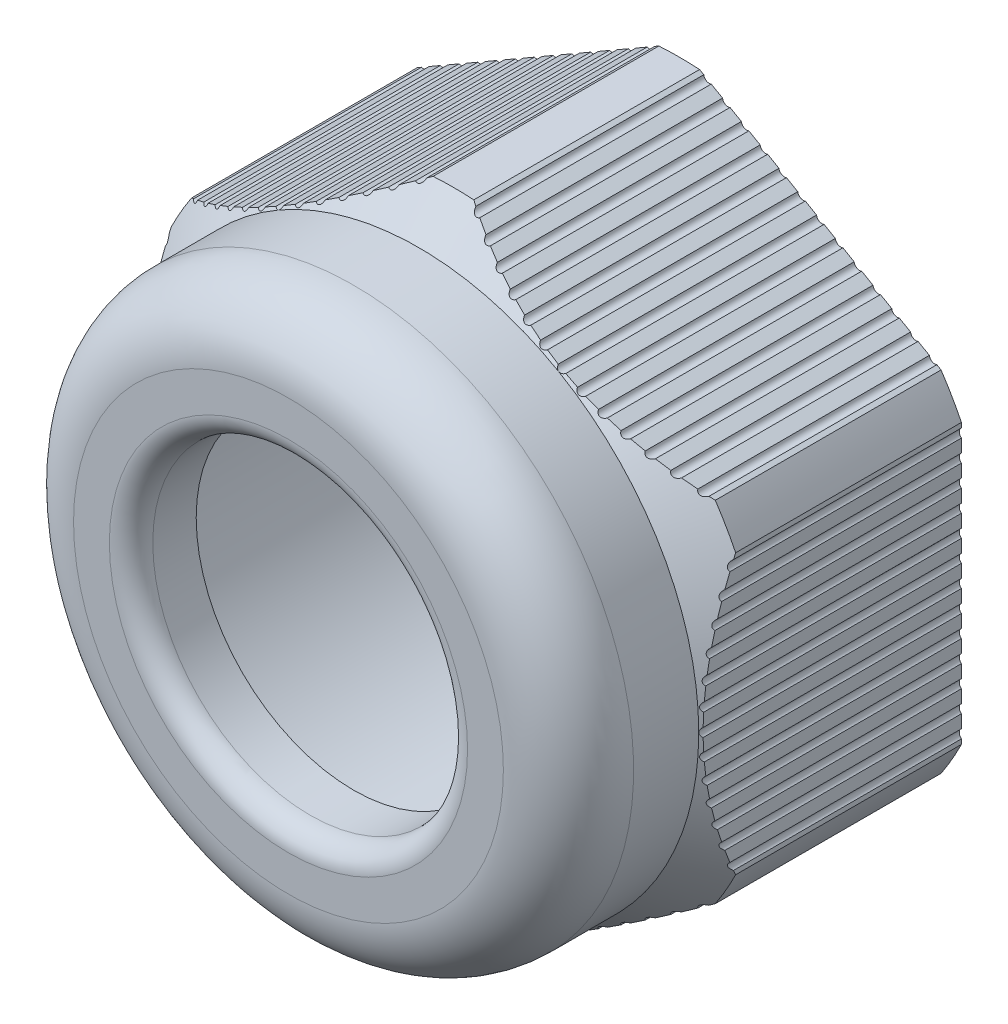
from build123d import *

# Parameters (mm, degrees)
EXTRUDE_1_DEPTH                     = 12
SKETCH_3_R                          = 15.011106999
SKETCH_3_R_2                        = 14.5
CUT_EXTRUDE_1_DEPTH                 = 12
SKETCH_4_R                          = 12.9
EXTRUDE_3_DEPTH                     = 6
FILLET_1_R                          = 3
SKETCH_5_R                          = 7.25
CUT_EXTRUDE_2_DEPTH                 = 27.518861212
SKETCH_6_R                          = 10.75
CUT_EXTRUDE_3_DEPTH                 = 15
FILLET_2_R                          = 1
CHAMFER_1_SIZE                      = 2
CHAMFER_1_SIZE2                     = 3.464101615
SKETCH_8_R                          = 0.25
CUT_EXTRUDE_4_DEPTH                 = 27.518861212
PATTERN_LINEAR_1_COUNT              = 7
PATTERN_LINEAR_1_PITCH              = 1
PATTERN_LINEAR_1_COL_COUNT          = 7
PATTERN_LINEAR_1_COL_PITCH          = 1
PATTERN_CIRCULAR_1_COUNT            = 6
PATTERN_CIRCULAR_1_COPY_1_SKETCH_R  = 0.25
PATTERN_CIRCULAR_1_COPY_1_DEPTH     = 27.518861212
PATTERN_CIRCULAR_1_COPY_2_SKETCH_R  = 0.25
PATTERN_CIRCULAR_1_COPY_2_DEPTH     = 27.518861212
PATTERN_CIRCULAR_1_COPY_3_SKETCH_R  = 0.25
PATTERN_CIRCULAR_1_COPY_3_DEPTH     = 27.518861212
PATTERN_CIRCULAR_1_COPY_4_SKETCH_R  = 0.25
PATTERN_CIRCULAR_1_COPY_4_DEPTH     = 27.518861212
PATTERN_CIRCULAR_1_COPY_5_SKETCH_R  = 0.25
PATTERN_CIRCULAR_1_COPY_5_DEPTH     = 27.518861212
PATTERN_CIRCULAR_1_COPY_6_SKETCH_R  = 0.25
PATTERN_CIRCULAR_1_COPY_6_DEPTH     = 27.518861212
PATTERN_CIRCULAR_1_COPY_7_SKETCH_R  = 0.25
PATTERN_CIRCULAR_1_COPY_7_DEPTH     = 27.518861212
PATTERN_CIRCULAR_1_COPY_8_SKETCH_R  = 0.25
PATTERN_CIRCULAR_1_COPY_8_DEPTH     = 27.518861212
PATTERN_CIRCULAR_1_COPY_9_SKETCH_R  = 0.25
PATTERN_CIRCULAR_1_COPY_9_DEPTH     = 27.518861212
PATTERN_CIRCULAR_1_COPY_10_SKETCH_R = 0.25
PATTERN_CIRCULAR_1_COPY_10_DEPTH    = 27.518861212
PATTERN_CIRCULAR_1_COPY_11_SKETCH_R = 0.25
PATTERN_CIRCULAR_1_COPY_11_DEPTH    = 27.518861212
PATTERN_CIRCULAR_1_COPY_12_SKETCH_R = 0.25
PATTERN_CIRCULAR_1_COPY_12_DEPTH    = 27.518861212
PATTERN_CIRCULAR_1_COPY_13_SKETCH_R = 0.25
PATTERN_CIRCULAR_1_COPY_13_DEPTH    = 27.518861212
PATTERN_CIRCULAR_1_COPY_14_SKETCH_R = 0.25
PATTERN_CIRCULAR_1_COPY_14_DEPTH    = 27.518861212
PATTERN_CIRCULAR_1_COPY_15_SKETCH_R = 0.25
PATTERN_CIRCULAR_1_COPY_15_DEPTH    = 27.518861212
PATTERN_CIRCULAR_1_COPY_16_SKETCH_R = 0.25
PATTERN_CIRCULAR_1_COPY_16_DEPTH    = 27.518861212
PATTERN_CIRCULAR_1_COPY_17_SKETCH_R = 0.25
PATTERN_CIRCULAR_1_COPY_17_DEPTH    = 27.518861212
PATTERN_CIRCULAR_1_COPY_18_SKETCH_R = 0.25
PATTERN_CIRCULAR_1_COPY_18_DEPTH    = 27.518861212
PATTERN_CIRCULAR_1_COPY_19_SKETCH_R = 0.25
PATTERN_CIRCULAR_1_COPY_19_DEPTH    = 27.518861212
PATTERN_CIRCULAR_1_COPY_20_SKETCH_R = 0.25
PATTERN_CIRCULAR_1_COPY_20_DEPTH    = 27.518861212
PATTERN_CIRCULAR_1_COPY_21_SKETCH_R = 0.25
PATTERN_CIRCULAR_1_COPY_21_DEPTH    = 27.518861212
PATTERN_CIRCULAR_1_COPY_22_SKETCH_R = 0.25
PATTERN_CIRCULAR_1_COPY_22_DEPTH    = 27.518861212
PATTERN_CIRCULAR_1_COPY_23_SKETCH_R = 0.25
PATTERN_CIRCULAR_1_COPY_23_DEPTH    = 27.518861212
PATTERN_CIRCULAR_1_COPY_24_SKETCH_R = 0.25
PATTERN_CIRCULAR_1_COPY_24_DEPTH    = 27.518861212
PATTERN_CIRCULAR_1_COPY_25_SKETCH_R = 0.25
PATTERN_CIRCULAR_1_COPY_25_DEPTH    = 27.518861212
PATTERN_CIRCULAR_1_COPY_26_SKETCH_R = 0.25
PATTERN_CIRCULAR_1_COPY_26_DEPTH    = 27.518861212
PATTERN_CIRCULAR_1_COPY_27_SKETCH_R = 0.25
PATTERN_CIRCULAR_1_COPY_27_DEPTH    = 27.518861212
PATTERN_CIRCULAR_1_COPY_28_SKETCH_R = 0.25
PATTERN_CIRCULAR_1_COPY_28_DEPTH    = 27.518861212
PATTERN_CIRCULAR_1_COPY_29_SKETCH_R = 0.25
PATTERN_CIRCULAR_1_COPY_29_DEPTH    = 27.518861212
PATTERN_CIRCULAR_1_COPY_30_SKETCH_R = 0.25
PATTERN_CIRCULAR_1_COPY_30_DEPTH    = 27.518861212
PATTERN_CIRCULAR_1_COPY_31_SKETCH_R = 0.25
PATTERN_CIRCULAR_1_COPY_31_DEPTH    = 27.518861212
PATTERN_CIRCULAR_1_COPY_32_SKETCH_R = 0.25
PATTERN_CIRCULAR_1_COPY_32_DEPTH    = 27.518861212
PATTERN_CIRCULAR_1_COPY_33_SKETCH_R = 0.25
PATTERN_CIRCULAR_1_COPY_33_DEPTH    = 27.518861212
PATTERN_CIRCULAR_1_COPY_34_SKETCH_R = 0.25
PATTERN_CIRCULAR_1_COPY_34_DEPTH    = 27.518861212
PATTERN_CIRCULAR_1_COPY_35_SKETCH_R = 0.25
PATTERN_CIRCULAR_1_COPY_35_DEPTH    = 27.518861212
PATTERN_CIRCULAR_1_COPY_36_SKETCH_R = 0.25
PATTERN_CIRCULAR_1_COPY_36_DEPTH    = 27.518861212
PATTERN_CIRCULAR_1_COPY_37_SKETCH_R = 0.25
PATTERN_CIRCULAR_1_COPY_37_DEPTH    = 27.518861212
PATTERN_CIRCULAR_1_COPY_38_SKETCH_R = 0.25
PATTERN_CIRCULAR_1_COPY_38_DEPTH    = 27.518861212
PATTERN_CIRCULAR_1_COPY_39_SKETCH_R = 0.25
PATTERN_CIRCULAR_1_COPY_39_DEPTH    = 27.518861212
PATTERN_CIRCULAR_1_COPY_40_SKETCH_R = 0.25
PATTERN_CIRCULAR_1_COPY_40_DEPTH    = 27.518861212
PATTERN_CIRCULAR_1_COPY_41_SKETCH_R = 0.25
PATTERN_CIRCULAR_1_COPY_41_DEPTH    = 27.518861212
PATTERN_CIRCULAR_1_COPY_42_SKETCH_R = 0.25
PATTERN_CIRCULAR_1_COPY_42_DEPTH    = 27.518861212
PATTERN_CIRCULAR_1_COPY_43_SKETCH_R = 0.25
PATTERN_CIRCULAR_1_COPY_43_DEPTH    = 27.518861212
PATTERN_CIRCULAR_1_COPY_44_SKETCH_R = 0.25
PATTERN_CIRCULAR_1_COPY_44_DEPTH    = 27.518861212
PATTERN_CIRCULAR_1_COPY_45_SKETCH_R = 0.25
PATTERN_CIRCULAR_1_COPY_45_DEPTH    = 27.518861212
PATTERN_CIRCULAR_1_COPY_46_SKETCH_R = 0.25
PATTERN_CIRCULAR_1_COPY_46_DEPTH    = 27.518861212
PATTERN_CIRCULAR_1_COPY_47_SKETCH_R = 0.25
PATTERN_CIRCULAR_1_COPY_47_DEPTH    = 27.518861212
PATTERN_CIRCULAR_1_COPY_48_SKETCH_R = 0.25
PATTERN_CIRCULAR_1_COPY_48_DEPTH    = 27.518861212
PATTERN_CIRCULAR_1_COPY_49_SKETCH_R = 0.25
PATTERN_CIRCULAR_1_COPY_49_DEPTH    = 27.518861212
PATTERN_CIRCULAR_1_COPY_50_SKETCH_R = 0.25
PATTERN_CIRCULAR_1_COPY_50_DEPTH    = 27.518861212
PATTERN_CIRCULAR_1_COPY_51_SKETCH_R = 0.25
PATTERN_CIRCULAR_1_COPY_51_DEPTH    = 27.518861212
PATTERN_CIRCULAR_1_COPY_52_SKETCH_R = 0.25
PATTERN_CIRCULAR_1_COPY_52_DEPTH    = 27.518861212
PATTERN_CIRCULAR_1_COPY_53_SKETCH_R = 0.25
PATTERN_CIRCULAR_1_COPY_53_DEPTH    = 27.518861212
PATTERN_CIRCULAR_1_COPY_54_SKETCH_R = 0.25
PATTERN_CIRCULAR_1_COPY_54_DEPTH    = 27.518861212
PATTERN_CIRCULAR_1_COPY_55_SKETCH_R = 0.25
PATTERN_CIRCULAR_1_COPY_55_DEPTH    = 27.518861212
PATTERN_CIRCULAR_1_COPY_56_SKETCH_R = 0.25
PATTERN_CIRCULAR_1_COPY_56_DEPTH    = 27.518861212
PATTERN_CIRCULAR_1_COPY_57_SKETCH_R = 0.25
PATTERN_CIRCULAR_1_COPY_57_DEPTH    = 27.518861212
PATTERN_CIRCULAR_1_COPY_58_SKETCH_R = 0.25
PATTERN_CIRCULAR_1_COPY_58_DEPTH    = 27.518861212
PATTERN_CIRCULAR_1_COPY_59_SKETCH_R = 0.25
PATTERN_CIRCULAR_1_COPY_59_DEPTH    = 27.518861212
PATTERN_CIRCULAR_1_COPY_60_SKETCH_R = 0.25
PATTERN_CIRCULAR_1_COPY_60_DEPTH    = 27.518861212


with BuildPart() as part:
    # Эскиз2 → Вытянуть1 (new body)
    with BuildSketch(Plane.XY):
        Polygon((0, 15.011106999), (-13, 7.505553499), (-13, -7.505553499), (0, -15.011106999), (13, -7.505553499), (13, 7.505553499), align=None)
    extrude(amount=EXTRUDE_1_DEPTH)

    # Эскиз3 → Вырез-Вытянуть1 (cut)
    with BuildSketch(Plane.XY.offset(12)):
        Circle(SKETCH_3_R)
        Circle(SKETCH_3_R_2, mode=Mode.SUBTRACT)
    extrude(amount=-CUT_EXTRUDE_1_DEPTH, mode=Mode.SUBTRACT)

    # Эскиз4 → Вытянуть3 (add)
    with BuildSketch(Plane.XY.offset(12)):
        with Locations(Location((0, 0, 0), (0, 0, 180))):
            Circle(SKETCH_4_R)
    extrude(amount=EXTRUDE_3_DEPTH)

    # Скругление1
    fillet_1_edges = [part.edges().sort_by_distance(p)[0] for p in [
        (12.9, 0, 18),
    ]]
    fillet(fillet_1_edges, radius=FILLET_1_R)

    # Эскиз5 → Вырез-Вытянуть2 (cut, through all)
    with BuildSketch(Plane.XY.offset(18)):
        Circle(SKETCH_5_R)
    extrude(amount=-CUT_EXTRUDE_2_DEPTH, mode=Mode.SUBTRACT)

    # Эскиз6 → Вырез-Вытянуть3 (cut)
    with BuildSketch(Plane(origin=(0, 0, 0), x_dir=(-1, 0, 0), z_dir=(0, 0, -1))):
        Circle(SKETCH_6_R)
    extrude(amount=-CUT_EXTRUDE_3_DEPTH, mode=Mode.SUBTRACT)

    # Скругление2
    fillet_2_edges = [part.edges().sort_by_distance(p)[0] for p in [
        (-7.25, 0, 18),
    ]]
    fillet(fillet_2_edges, radius=FILLET_2_R)

    # Фаска1
    chamfer_1_edges = [part.edges().sort_by_distance(p)[0] for p in [
        (10.75, 0, 15),
    ]]
    chamfer_1_side = [part.faces().sort_by_distance(p)[0] for p in [
        (10.75, 0, 7.5),
    ]]
    chamfer(chamfer_1_edges, length=CHAMFER_1_SIZE, length2=CHAMFER_1_SIZE2, reference=chamfer_1_side[0])

    # Эскиз7 → Вырез-Повернуть1 (revolve, cut)
    with BuildSketch(Plane(origin=(0, 0, 0), x_dir=(0, 0, -1), z_dir=(1, 0, 0)), mode=Mode.PRIVATE) as cut_revolve_1_sk:
        Polygon((-12, 12.9), (-10, 14.9), (-12, 14.9), align=None)
    revolve(cut_revolve_1_sk.sketch.rotate(Axis((0, 0, 27.165147353), (0, 0, -1)), 270), axis=Axis((0, 0, 27.165147353), (0, 0, -1)), mode=Mode.SUBTRACT)

    # Эскиз8 → Вырез-Вытянуть4 (cut, through all)
    with BuildSketch(Plane(origin=(0, 0, 0), x_dir=(-1, 0, 0), z_dir=(0, 0, -1))):
        with Locations((-6.575, 11.38823406)):
            Circle(SKETCH_8_R)
    cut_extrude_4 = extrude(amount=-CUT_EXTRUDE_4_DEPTH, mode=Mode.SUBTRACT)

    # Линейный массив1: Вырез-Вытянуть4 ×7
    with Locations(*[Vector(-0.8660254037844363, 0.5000000000000041, 0) * (i * PATTERN_LINEAR_1_PITCH) for i in range(1, PATTERN_LINEAR_1_COUNT)]):
        add(cut_extrude_4, mode=Mode.SUBTRACT)

    # Линейный массив1 col: Вырез-Вытянуть4 ×7
    with Locations(*[Vector(0.8660254037844363, -0.5000000000000041, 0) * (i * PATTERN_LINEAR_1_COL_PITCH) for i in range(1, PATTERN_LINEAR_1_COL_COUNT)]):
        add(cut_extrude_4, mode=Mode.SUBTRACT)

    # Круговой массив1: Вырез-Вытянуть4 ×6 about axis
    pattern_circular_1_axis = Axis((0, 0, 0), (0, 0, 1))
    for i in range(1, PATTERN_CIRCULAR_1_COUNT):
        add(cut_extrude_4.rotate(pattern_circular_1_axis, i * 360 / PATTERN_CIRCULAR_1_COUNT), mode=Mode.SUBTRACT)

    # Круговой массив1 copy 1 sketch → Круговой массив1 copy 1 (cut, through all)
    with BuildSketch(Plane(origin=(-0.8660254037844429, -0.499999999999996, 0), x_dir=(-0.5000000000000001, -0.8660254037844386, 0), z_dir=(0, 0, -1))):
        with Locations((-6.575, 11.38823406)):
            Circle(PATTERN_CIRCULAR_1_COPY_1_SKETCH_R)
    extrude(amount=-PATTERN_CIRCULAR_1_COPY_1_DEPTH, mode=Mode.SUBTRACT)

    # Круговой массив1 copy 2 sketch → Круговой массив1 copy 2 (cut, through all)
    with BuildSketch(Plane(origin=(0, -1, 0), x_dir=(0.4999999999999998, -0.8660254037844387, 0), z_dir=(0, 0, -1))):
        with Locations((-6.575, 11.38823406)):
            Circle(PATTERN_CIRCULAR_1_COPY_2_SKETCH_R)
    extrude(amount=-PATTERN_CIRCULAR_1_COPY_2_DEPTH, mode=Mode.SUBTRACT)

    # Круговой массив1 copy 3 sketch → Круговой массив1 copy 3 (cut, through all)
    with BuildSketch(Plane(origin=(0.8660254037844347, -0.5000000000000077, 0), x_dir=(1, 0, 0), z_dir=(0, 0, -1))):
        with Locations((-6.575, 11.38823406)):
            Circle(PATTERN_CIRCULAR_1_COPY_3_SKETCH_R)
    extrude(amount=-PATTERN_CIRCULAR_1_COPY_3_DEPTH, mode=Mode.SUBTRACT)

    # Круговой массив1 copy 4 sketch → Круговой массив1 copy 4 (cut, through all)
    with BuildSketch(Plane(origin=(0.8660254037844417, 0.4999999999999922, 0), x_dir=(0.5000000000000004, 0.8660254037844384, 0), z_dir=(0, 0, -1))):
        with Locations((-6.575, 11.38823406)):
            Circle(PATTERN_CIRCULAR_1_COPY_4_SKETCH_R)
    extrude(amount=-PATTERN_CIRCULAR_1_COPY_4_DEPTH, mode=Mode.SUBTRACT)

    # Круговой массив1 copy 5 sketch → Круговой массив1 copy 5 (cut, through all)
    with BuildSketch(Plane(origin=(0, 1, 0), x_dir=(-0.5000000000000001, 0.8660254037844386, 0), z_dir=(0, 0, -1))):
        with Locations((-6.575, 11.38823406)):
            Circle(PATTERN_CIRCULAR_1_COPY_5_SKETCH_R)
    extrude(amount=-PATTERN_CIRCULAR_1_COPY_5_DEPTH, mode=Mode.SUBTRACT)

    # Круговой массив1 copy 6 sketch → Круговой массив1 copy 6 (cut, through all)
    with BuildSketch(Plane(origin=(-1.732050808, -1, 0), x_dir=(-0.5000000000000001, -0.8660254037844386, 0), z_dir=(0, 0, -1))):
        with Locations((-6.575, 11.38823406)):
            Circle(PATTERN_CIRCULAR_1_COPY_6_SKETCH_R)
    extrude(amount=-PATTERN_CIRCULAR_1_COPY_6_DEPTH, mode=Mode.SUBTRACT)

    # Круговой массив1 copy 7 sketch → Круговой массив1 copy 7 (cut, through all)
    with BuildSketch(Plane(origin=(0, -2, 0), x_dir=(0.4999999999999998, -0.8660254037844387, 0), z_dir=(0, 0, -1))):
        with Locations((-6.575, 11.38823406)):
            Circle(PATTERN_CIRCULAR_1_COPY_7_SKETCH_R)
    extrude(amount=-PATTERN_CIRCULAR_1_COPY_7_DEPTH, mode=Mode.SUBTRACT)

    # Круговой массив1 copy 8 sketch → Круговой массив1 copy 8 (cut, through all)
    with BuildSketch(Plane(origin=(1.732050808, -1, 0), x_dir=(1, 0, 0), z_dir=(0, 0, -1))):
        with Locations((-6.575, 11.38823406)):
            Circle(PATTERN_CIRCULAR_1_COPY_8_SKETCH_R)
    extrude(amount=-PATTERN_CIRCULAR_1_COPY_8_DEPTH, mode=Mode.SUBTRACT)

    # Круговой массив1 copy 9 sketch → Круговой массив1 copy 9 (cut, through all)
    with BuildSketch(Plane(origin=(1.732050808, 1, 0), x_dir=(0.5000000000000004, 0.8660254037844384, 0), z_dir=(0, 0, -1))):
        with Locations((-6.575, 11.38823406)):
            Circle(PATTERN_CIRCULAR_1_COPY_9_SKETCH_R)
    extrude(amount=-PATTERN_CIRCULAR_1_COPY_9_DEPTH, mode=Mode.SUBTRACT)

    # Круговой массив1 copy 10 sketch → Круговой массив1 copy 10 (cut, through all)
    with BuildSketch(Plane(origin=(0, 2, 0), x_dir=(-0.5000000000000001, 0.8660254037844386, 0), z_dir=(0, 0, -1))):
        with Locations((-6.575, 11.38823406)):
            Circle(PATTERN_CIRCULAR_1_COPY_10_SKETCH_R)
    extrude(amount=-PATTERN_CIRCULAR_1_COPY_10_DEPTH, mode=Mode.SUBTRACT)

    # Круговой массив1 copy 11 sketch → Круговой массив1 copy 11 (cut, through all)
    with BuildSketch(Plane(origin=(-2.598076211, -1.5, 0), x_dir=(-0.5000000000000001, -0.8660254037844386, 0), z_dir=(0, 0, -1))):
        with Locations((-6.575, 11.38823406)):
            Circle(PATTERN_CIRCULAR_1_COPY_11_SKETCH_R)
    extrude(amount=-PATTERN_CIRCULAR_1_COPY_11_DEPTH, mode=Mode.SUBTRACT)

    # Круговой массив1 copy 12 sketch → Круговой массив1 copy 12 (cut, through all)
    with BuildSketch(Plane(origin=(0, -3, 0), x_dir=(0.4999999999999998, -0.8660254037844387, 0), z_dir=(0, 0, -1))):
        with Locations((-6.575, 11.38823406)):
            Circle(PATTERN_CIRCULAR_1_COPY_12_SKETCH_R)
    extrude(amount=-PATTERN_CIRCULAR_1_COPY_12_DEPTH, mode=Mode.SUBTRACT)

    # Круговой массив1 copy 13 sketch → Круговой массив1 copy 13 (cut, through all)
    with BuildSketch(Plane(origin=(2.598076211, -1.5, 0), x_dir=(1, 0, 0), z_dir=(0, 0, -1))):
        with Locations((-6.575, 11.38823406)):
            Circle(PATTERN_CIRCULAR_1_COPY_13_SKETCH_R)
    extrude(amount=-PATTERN_CIRCULAR_1_COPY_13_DEPTH, mode=Mode.SUBTRACT)

    # Круговой массив1 copy 14 sketch → Круговой массив1 copy 14 (cut, through all)
    with BuildSketch(Plane(origin=(2.598076211, 1.5, 0), x_dir=(0.5000000000000004, 0.8660254037844384, 0), z_dir=(0, 0, -1))):
        with Locations((-6.575, 11.38823406)):
            Circle(PATTERN_CIRCULAR_1_COPY_14_SKETCH_R)
    extrude(amount=-PATTERN_CIRCULAR_1_COPY_14_DEPTH, mode=Mode.SUBTRACT)

    # Круговой массив1 copy 15 sketch → Круговой массив1 copy 15 (cut, through all)
    with BuildSketch(Plane(origin=(0, 3, 0), x_dir=(-0.5000000000000001, 0.8660254037844386, 0), z_dir=(0, 0, -1))):
        with Locations((-6.575, 11.38823406)):
            Circle(PATTERN_CIRCULAR_1_COPY_15_SKETCH_R)
    extrude(amount=-PATTERN_CIRCULAR_1_COPY_15_DEPTH, mode=Mode.SUBTRACT)

    # Круговой массив1 copy 16 sketch → Круговой массив1 copy 16 (cut, through all)
    with BuildSketch(Plane(origin=(-3.464101615, -2, 0), x_dir=(-0.5000000000000001, -0.8660254037844386, 0), z_dir=(0, 0, -1))):
        with Locations((-6.575, 11.38823406)):
            Circle(PATTERN_CIRCULAR_1_COPY_16_SKETCH_R)
    extrude(amount=-PATTERN_CIRCULAR_1_COPY_16_DEPTH, mode=Mode.SUBTRACT)

    # Круговой массив1 copy 17 sketch → Круговой массив1 copy 17 (cut, through all)
    with BuildSketch(Plane(origin=(0, -4, 0), x_dir=(0.4999999999999998, -0.8660254037844387, 0), z_dir=(0, 0, -1))):
        with Locations((-6.575, 11.38823406)):
            Circle(PATTERN_CIRCULAR_1_COPY_17_SKETCH_R)
    extrude(amount=-PATTERN_CIRCULAR_1_COPY_17_DEPTH, mode=Mode.SUBTRACT)

    # Круговой массив1 copy 18 sketch → Круговой массив1 copy 18 (cut, through all)
    with BuildSketch(Plane(origin=(3.464101615, -2, 0), x_dir=(1, 0, 0), z_dir=(0, 0, -1))):
        with Locations((-6.575, 11.38823406)):
            Circle(PATTERN_CIRCULAR_1_COPY_18_SKETCH_R)
    extrude(amount=-PATTERN_CIRCULAR_1_COPY_18_DEPTH, mode=Mode.SUBTRACT)

    # Круговой массив1 copy 19 sketch → Круговой массив1 copy 19 (cut, through all)
    with BuildSketch(Plane(origin=(3.464101615, 2, 0), x_dir=(0.5000000000000004, 0.8660254037844384, 0), z_dir=(0, 0, -1))):
        with Locations((-6.575, 11.38823406)):
            Circle(PATTERN_CIRCULAR_1_COPY_19_SKETCH_R)
    extrude(amount=-PATTERN_CIRCULAR_1_COPY_19_DEPTH, mode=Mode.SUBTRACT)

    # Круговой массив1 copy 20 sketch → Круговой массив1 copy 20 (cut, through all)
    with BuildSketch(Plane(origin=(0, 4, 0), x_dir=(-0.5000000000000001, 0.8660254037844386, 0), z_dir=(0, 0, -1))):
        with Locations((-6.575, 11.38823406)):
            Circle(PATTERN_CIRCULAR_1_COPY_20_SKETCH_R)
    extrude(amount=-PATTERN_CIRCULAR_1_COPY_20_DEPTH, mode=Mode.SUBTRACT)

    # Круговой массив1 copy 21 sketch → Круговой массив1 copy 21 (cut, through all)
    with BuildSketch(Plane(origin=(-4.330127019, -2.5, 0), x_dir=(-0.5000000000000001, -0.8660254037844386, 0), z_dir=(0, 0, -1))):
        with Locations((-6.575, 11.38823406)):
            Circle(PATTERN_CIRCULAR_1_COPY_21_SKETCH_R)
    extrude(amount=-PATTERN_CIRCULAR_1_COPY_21_DEPTH, mode=Mode.SUBTRACT)

    # Круговой массив1 copy 22 sketch → Круговой массив1 copy 22 (cut, through all)
    with BuildSketch(Plane(origin=(0, -5, 0), x_dir=(0.4999999999999998, -0.8660254037844387, 0), z_dir=(0, 0, -1))):
        with Locations((-6.575, 11.38823406)):
            Circle(PATTERN_CIRCULAR_1_COPY_22_SKETCH_R)
    extrude(amount=-PATTERN_CIRCULAR_1_COPY_22_DEPTH, mode=Mode.SUBTRACT)

    # Круговой массив1 copy 23 sketch → Круговой массив1 copy 23 (cut, through all)
    with BuildSketch(Plane(origin=(4.330127019, -2.5, 0), x_dir=(1, 0, 0), z_dir=(0, 0, -1))):
        with Locations((-6.575, 11.38823406)):
            Circle(PATTERN_CIRCULAR_1_COPY_23_SKETCH_R)
    extrude(amount=-PATTERN_CIRCULAR_1_COPY_23_DEPTH, mode=Mode.SUBTRACT)

    # Круговой массив1 copy 24 sketch → Круговой массив1 copy 24 (cut, through all)
    with BuildSketch(Plane(origin=(4.330127019, 2.5, 0), x_dir=(0.5000000000000004, 0.8660254037844384, 0), z_dir=(0, 0, -1))):
        with Locations((-6.575, 11.38823406)):
            Circle(PATTERN_CIRCULAR_1_COPY_24_SKETCH_R)
    extrude(amount=-PATTERN_CIRCULAR_1_COPY_24_DEPTH, mode=Mode.SUBTRACT)

    # Круговой массив1 copy 25 sketch → Круговой массив1 copy 25 (cut, through all)
    with BuildSketch(Plane(origin=(0, 5, 0), x_dir=(-0.5000000000000001, 0.8660254037844386, 0), z_dir=(0, 0, -1))):
        with Locations((-6.575, 11.38823406)):
            Circle(PATTERN_CIRCULAR_1_COPY_25_SKETCH_R)
    extrude(amount=-PATTERN_CIRCULAR_1_COPY_25_DEPTH, mode=Mode.SUBTRACT)

    # Круговой массив1 copy 26 sketch → Круговой массив1 copy 26 (cut, through all)
    with BuildSketch(Plane(origin=(-5.196152423, -3, 0), x_dir=(-0.5000000000000001, -0.8660254037844386, 0), z_dir=(0, 0, -1))):
        with Locations((-6.575, 11.38823406)):
            Circle(PATTERN_CIRCULAR_1_COPY_26_SKETCH_R)
    extrude(amount=-PATTERN_CIRCULAR_1_COPY_26_DEPTH, mode=Mode.SUBTRACT)

    # Круговой массив1 copy 27 sketch → Круговой массив1 copy 27 (cut, through all)
    with BuildSketch(Plane(origin=(0, -6, 0), x_dir=(0.4999999999999998, -0.8660254037844387, 0), z_dir=(0, 0, -1))):
        with Locations((-6.575, 11.38823406)):
            Circle(PATTERN_CIRCULAR_1_COPY_27_SKETCH_R)
    extrude(amount=-PATTERN_CIRCULAR_1_COPY_27_DEPTH, mode=Mode.SUBTRACT)

    # Круговой массив1 copy 28 sketch → Круговой массив1 copy 28 (cut, through all)
    with BuildSketch(Plane(origin=(5.196152423, -3, 0), x_dir=(1, 0, 0), z_dir=(0, 0, -1))):
        with Locations((-6.575, 11.38823406)):
            Circle(PATTERN_CIRCULAR_1_COPY_28_SKETCH_R)
    extrude(amount=-PATTERN_CIRCULAR_1_COPY_28_DEPTH, mode=Mode.SUBTRACT)

    # Круговой массив1 copy 29 sketch → Круговой массив1 copy 29 (cut, through all)
    with BuildSketch(Plane(origin=(5.196152423, 3, 0), x_dir=(0.5000000000000004, 0.8660254037844384, 0), z_dir=(0, 0, -1))):
        with Locations((-6.575, 11.38823406)):
            Circle(PATTERN_CIRCULAR_1_COPY_29_SKETCH_R)
    extrude(amount=-PATTERN_CIRCULAR_1_COPY_29_DEPTH, mode=Mode.SUBTRACT)

    # Круговой массив1 copy 30 sketch → Круговой массив1 copy 30 (cut, through all)
    with BuildSketch(Plane(origin=(0, 6, 0), x_dir=(-0.5000000000000001, 0.8660254037844386, 0), z_dir=(0, 0, -1))):
        with Locations((-6.575, 11.38823406)):
            Circle(PATTERN_CIRCULAR_1_COPY_30_SKETCH_R)
    extrude(amount=-PATTERN_CIRCULAR_1_COPY_30_DEPTH, mode=Mode.SUBTRACT)

    # Круговой массив1 copy 31 sketch → Круговой массив1 copy 31 (cut, through all)
    with BuildSketch(Plane(origin=(0.8660254037844392, 0.49999999999999556, 0), x_dir=(-0.5000000000000001, -0.8660254037844386, 0), z_dir=(0, 0, -1))):
        with Locations((-6.575, 11.38823406)):
            Circle(PATTERN_CIRCULAR_1_COPY_31_SKETCH_R)
    extrude(amount=-PATTERN_CIRCULAR_1_COPY_31_DEPTH, mode=Mode.SUBTRACT)

    # Круговой массив1 copy 32 sketch → Круговой массив1 copy 32 (cut, through all)
    with BuildSketch(Plane(origin=(0, 1, 0), x_dir=(0.4999999999999998, -0.8660254037844387, 0), z_dir=(0, 0, -1))):
        with Locations((-6.575, 11.38823406)):
            Circle(PATTERN_CIRCULAR_1_COPY_32_SKETCH_R)
    extrude(amount=-PATTERN_CIRCULAR_1_COPY_32_DEPTH, mode=Mode.SUBTRACT)

    # Круговой массив1 copy 33 sketch → Круговой массив1 copy 33 (cut, through all)
    with BuildSketch(Plane(origin=(-0.8660254037844376, 0.5000000000000008, 0), x_dir=(1, 0, 0), z_dir=(0, 0, -1))):
        with Locations((-6.575, 11.38823406)):
            Circle(PATTERN_CIRCULAR_1_COPY_33_SKETCH_R)
    extrude(amount=-PATTERN_CIRCULAR_1_COPY_33_DEPTH, mode=Mode.SUBTRACT)

    # Круговой массив1 copy 34 sketch → Круговой массив1 copy 34 (cut, through all)
    with BuildSketch(Plane(origin=(-0.8660254037844408, -0.4999999999999986, 0), x_dir=(0.5000000000000004, 0.8660254037844384, 0), z_dir=(0, 0, -1))):
        with Locations((-6.575, 11.38823406)):
            Circle(PATTERN_CIRCULAR_1_COPY_34_SKETCH_R)
    extrude(amount=-PATTERN_CIRCULAR_1_COPY_34_DEPTH, mode=Mode.SUBTRACT)

    # Круговой массив1 copy 35 sketch → Круговой массив1 copy 35 (cut, through all)
    with BuildSketch(Plane(origin=(0, -1, 0), x_dir=(-0.5000000000000001, 0.8660254037844386, 0), z_dir=(0, 0, -1))):
        with Locations((-6.575, 11.38823406)):
            Circle(PATTERN_CIRCULAR_1_COPY_35_SKETCH_R)
    extrude(amount=-PATTERN_CIRCULAR_1_COPY_35_DEPTH, mode=Mode.SUBTRACT)

    # Круговой массив1 copy 36 sketch → Круговой массив1 copy 36 (cut, through all)
    with BuildSketch(Plane(origin=(1.732050808, 1, 0), x_dir=(-0.5000000000000001, -0.8660254037844386, 0), z_dir=(0, 0, -1))):
        with Locations((-6.575, 11.38823406)):
            Circle(PATTERN_CIRCULAR_1_COPY_36_SKETCH_R)
    extrude(amount=-PATTERN_CIRCULAR_1_COPY_36_DEPTH, mode=Mode.SUBTRACT)

    # Круговой массив1 copy 37 sketch → Круговой массив1 copy 37 (cut, through all)
    with BuildSketch(Plane(origin=(0, 2, 0), x_dir=(0.4999999999999998, -0.8660254037844387, 0), z_dir=(0, 0, -1))):
        with Locations((-6.575, 11.38823406)):
            Circle(PATTERN_CIRCULAR_1_COPY_37_SKETCH_R)
    extrude(amount=-PATTERN_CIRCULAR_1_COPY_37_DEPTH, mode=Mode.SUBTRACT)

    # Круговой массив1 copy 38 sketch → Круговой массив1 copy 38 (cut, through all)
    with BuildSketch(Plane(origin=(-1.732050808, 1, 0), x_dir=(1, 0, 0), z_dir=(0, 0, -1))):
        with Locations((-6.575, 11.38823406)):
            Circle(PATTERN_CIRCULAR_1_COPY_38_SKETCH_R)
    extrude(amount=-PATTERN_CIRCULAR_1_COPY_38_DEPTH, mode=Mode.SUBTRACT)

    # Круговой массив1 copy 39 sketch → Круговой массив1 copy 39 (cut, through all)
    with BuildSketch(Plane(origin=(-1.732050808, -1, 0), x_dir=(0.5000000000000004, 0.8660254037844384, 0), z_dir=(0, 0, -1))):
        with Locations((-6.575, 11.38823406)):
            Circle(PATTERN_CIRCULAR_1_COPY_39_SKETCH_R)
    extrude(amount=-PATTERN_CIRCULAR_1_COPY_39_DEPTH, mode=Mode.SUBTRACT)

    # Круговой массив1 copy 40 sketch → Круговой массив1 copy 40 (cut, through all)
    with BuildSketch(Plane(origin=(0, -2, 0), x_dir=(-0.5000000000000001, 0.8660254037844386, 0), z_dir=(0, 0, -1))):
        with Locations((-6.575, 11.38823406)):
            Circle(PATTERN_CIRCULAR_1_COPY_40_SKETCH_R)
    extrude(amount=-PATTERN_CIRCULAR_1_COPY_40_DEPTH, mode=Mode.SUBTRACT)

    # Круговой массив1 copy 41 sketch → Круговой массив1 copy 41 (cut, through all)
    with BuildSketch(Plane(origin=(2.598076211, 1.5, 0), x_dir=(-0.5000000000000001, -0.8660254037844386, 0), z_dir=(0, 0, -1))):
        with Locations((-6.575, 11.38823406)):
            Circle(PATTERN_CIRCULAR_1_COPY_41_SKETCH_R)
    extrude(amount=-PATTERN_CIRCULAR_1_COPY_41_DEPTH, mode=Mode.SUBTRACT)

    # Круговой массив1 copy 42 sketch → Круговой массив1 copy 42 (cut, through all)
    with BuildSketch(Plane(origin=(0, 3, 0), x_dir=(0.4999999999999998, -0.8660254037844387, 0), z_dir=(0, 0, -1))):
        with Locations((-6.575, 11.38823406)):
            Circle(PATTERN_CIRCULAR_1_COPY_42_SKETCH_R)
    extrude(amount=-PATTERN_CIRCULAR_1_COPY_42_DEPTH, mode=Mode.SUBTRACT)

    # Круговой массив1 copy 43 sketch → Круговой массив1 copy 43 (cut, through all)
    with BuildSketch(Plane(origin=(-2.598076211, 1.5, 0), x_dir=(1, 0, 0), z_dir=(0, 0, -1))):
        with Locations((-6.575, 11.38823406)):
            Circle(PATTERN_CIRCULAR_1_COPY_43_SKETCH_R)
    extrude(amount=-PATTERN_CIRCULAR_1_COPY_43_DEPTH, mode=Mode.SUBTRACT)

    # Круговой массив1 copy 44 sketch → Круговой массив1 copy 44 (cut, through all)
    with BuildSketch(Plane(origin=(-2.598076211, -1.5, 0), x_dir=(0.5000000000000004, 0.8660254037844384, 0), z_dir=(0, 0, -1))):
        with Locations((-6.575, 11.38823406)):
            Circle(PATTERN_CIRCULAR_1_COPY_44_SKETCH_R)
    extrude(amount=-PATTERN_CIRCULAR_1_COPY_44_DEPTH, mode=Mode.SUBTRACT)

    # Круговой массив1 copy 45 sketch → Круговой массив1 copy 45 (cut, through all)
    with BuildSketch(Plane(origin=(0, -3, 0), x_dir=(-0.5000000000000001, 0.8660254037844386, 0), z_dir=(0, 0, -1))):
        with Locations((-6.575, 11.38823406)):
            Circle(PATTERN_CIRCULAR_1_COPY_45_SKETCH_R)
    extrude(amount=-PATTERN_CIRCULAR_1_COPY_45_DEPTH, mode=Mode.SUBTRACT)

    # Круговой массив1 copy 46 sketch → Круговой массив1 copy 46 (cut, through all)
    with BuildSketch(Plane(origin=(3.464101615, 2, 0), x_dir=(-0.5000000000000001, -0.8660254037844386, 0), z_dir=(0, 0, -1))):
        with Locations((-6.575, 11.38823406)):
            Circle(PATTERN_CIRCULAR_1_COPY_46_SKETCH_R)
    extrude(amount=-PATTERN_CIRCULAR_1_COPY_46_DEPTH, mode=Mode.SUBTRACT)

    # Круговой массив1 copy 47 sketch → Круговой массив1 copy 47 (cut, through all)
    with BuildSketch(Plane(origin=(0, 4, 0), x_dir=(0.4999999999999998, -0.8660254037844387, 0), z_dir=(0, 0, -1))):
        with Locations((-6.575, 11.38823406)):
            Circle(PATTERN_CIRCULAR_1_COPY_47_SKETCH_R)
    extrude(amount=-PATTERN_CIRCULAR_1_COPY_47_DEPTH, mode=Mode.SUBTRACT)

    # Круговой массив1 copy 48 sketch → Круговой массив1 copy 48 (cut, through all)
    with BuildSketch(Plane(origin=(-3.464101615, 2, 0), x_dir=(1, 0, 0), z_dir=(0, 0, -1))):
        with Locations((-6.575, 11.38823406)):
            Circle(PATTERN_CIRCULAR_1_COPY_48_SKETCH_R)
    extrude(amount=-PATTERN_CIRCULAR_1_COPY_48_DEPTH, mode=Mode.SUBTRACT)

    # Круговой массив1 copy 49 sketch → Круговой массив1 copy 49 (cut, through all)
    with BuildSketch(Plane(origin=(-3.464101615, -2, 0), x_dir=(0.5000000000000004, 0.8660254037844384, 0), z_dir=(0, 0, -1))):
        with Locations((-6.575, 11.38823406)):
            Circle(PATTERN_CIRCULAR_1_COPY_49_SKETCH_R)
    extrude(amount=-PATTERN_CIRCULAR_1_COPY_49_DEPTH, mode=Mode.SUBTRACT)

    # Круговой массив1 copy 50 sketch → Круговой массив1 copy 50 (cut, through all)
    with BuildSketch(Plane(origin=(0, -4, 0), x_dir=(-0.5000000000000001, 0.8660254037844386, 0), z_dir=(0, 0, -1))):
        with Locations((-6.575, 11.38823406)):
            Circle(PATTERN_CIRCULAR_1_COPY_50_SKETCH_R)
    extrude(amount=-PATTERN_CIRCULAR_1_COPY_50_DEPTH, mode=Mode.SUBTRACT)

    # Круговой массив1 copy 51 sketch → Круговой массив1 copy 51 (cut, through all)
    with BuildSketch(Plane(origin=(4.330127019, 2.5, 0), x_dir=(-0.5000000000000001, -0.8660254037844386, 0), z_dir=(0, 0, -1))):
        with Locations((-6.575, 11.38823406)):
            Circle(PATTERN_CIRCULAR_1_COPY_51_SKETCH_R)
    extrude(amount=-PATTERN_CIRCULAR_1_COPY_51_DEPTH, mode=Mode.SUBTRACT)

    # Круговой массив1 copy 52 sketch → Круговой массив1 copy 52 (cut, through all)
    with BuildSketch(Plane(origin=(0, 5, 0), x_dir=(0.4999999999999998, -0.8660254037844387, 0), z_dir=(0, 0, -1))):
        with Locations((-6.575, 11.38823406)):
            Circle(PATTERN_CIRCULAR_1_COPY_52_SKETCH_R)
    extrude(amount=-PATTERN_CIRCULAR_1_COPY_52_DEPTH, mode=Mode.SUBTRACT)

    # Круговой массив1 copy 53 sketch → Круговой массив1 copy 53 (cut, through all)
    with BuildSketch(Plane(origin=(-4.330127019, 2.5, 0), x_dir=(1, 0, 0), z_dir=(0, 0, -1))):
        with Locations((-6.575, 11.38823406)):
            Circle(PATTERN_CIRCULAR_1_COPY_53_SKETCH_R)
    extrude(amount=-PATTERN_CIRCULAR_1_COPY_53_DEPTH, mode=Mode.SUBTRACT)

    # Круговой массив1 copy 54 sketch → Круговой массив1 copy 54 (cut, through all)
    with BuildSketch(Plane(origin=(-4.330127019, -2.5, 0), x_dir=(0.5000000000000004, 0.8660254037844384, 0), z_dir=(0, 0, -1))):
        with Locations((-6.575, 11.38823406)):
            Circle(PATTERN_CIRCULAR_1_COPY_54_SKETCH_R)
    extrude(amount=-PATTERN_CIRCULAR_1_COPY_54_DEPTH, mode=Mode.SUBTRACT)

    # Круговой массив1 copy 55 sketch → Круговой массив1 copy 55 (cut, through all)
    with BuildSketch(Plane(origin=(0, -5, 0), x_dir=(-0.5000000000000001, 0.8660254037844386, 0), z_dir=(0, 0, -1))):
        with Locations((-6.575, 11.38823406)):
            Circle(PATTERN_CIRCULAR_1_COPY_55_SKETCH_R)
    extrude(amount=-PATTERN_CIRCULAR_1_COPY_55_DEPTH, mode=Mode.SUBTRACT)

    # Круговой массив1 copy 56 sketch → Круговой массив1 copy 56 (cut, through all)
    with BuildSketch(Plane(origin=(5.196152423, 3, 0), x_dir=(-0.5000000000000001, -0.8660254037844386, 0), z_dir=(0, 0, -1))):
        with Locations((-6.575, 11.38823406)):
            Circle(PATTERN_CIRCULAR_1_COPY_56_SKETCH_R)
    extrude(amount=-PATTERN_CIRCULAR_1_COPY_56_DEPTH, mode=Mode.SUBTRACT)

    # Круговой массив1 copy 57 sketch → Круговой массив1 copy 57 (cut, through all)
    with BuildSketch(Plane(origin=(0, 6, 0), x_dir=(0.4999999999999998, -0.8660254037844387, 0), z_dir=(0, 0, -1))):
        with Locations((-6.575, 11.38823406)):
            Circle(PATTERN_CIRCULAR_1_COPY_57_SKETCH_R)
    extrude(amount=-PATTERN_CIRCULAR_1_COPY_57_DEPTH, mode=Mode.SUBTRACT)

    # Круговой массив1 copy 58 sketch → Круговой массив1 copy 58 (cut, through all)
    with BuildSketch(Plane(origin=(-5.196152423, 3, 0), x_dir=(1, 0, 0), z_dir=(0, 0, -1))):
        with Locations((-6.575, 11.38823406)):
            Circle(PATTERN_CIRCULAR_1_COPY_58_SKETCH_R)
    extrude(amount=-PATTERN_CIRCULAR_1_COPY_58_DEPTH, mode=Mode.SUBTRACT)

    # Круговой массив1 copy 59 sketch → Круговой массив1 copy 59 (cut, through all)
    with BuildSketch(Plane(origin=(-5.196152423, -3, 0), x_dir=(0.5000000000000004, 0.8660254037844384, 0), z_dir=(0, 0, -1))):
        with Locations((-6.575, 11.38823406)):
            Circle(PATTERN_CIRCULAR_1_COPY_59_SKETCH_R)
    extrude(amount=-PATTERN_CIRCULAR_1_COPY_59_DEPTH, mode=Mode.SUBTRACT)

    # Круговой массив1 copy 60 sketch → Круговой массив1 copy 60 (cut, through all)
    with BuildSketch(Plane(origin=(0, -6, 0), x_dir=(-0.5000000000000001, 0.8660254037844386, 0), z_dir=(0, 0, -1))):
        with Locations((-6.575, 11.38823406)):
            Circle(PATTERN_CIRCULAR_1_COPY_60_SKETCH_R)
    extrude(amount=-PATTERN_CIRCULAR_1_COPY_60_DEPTH, mode=Mode.SUBTRACT)


solid = part.part
